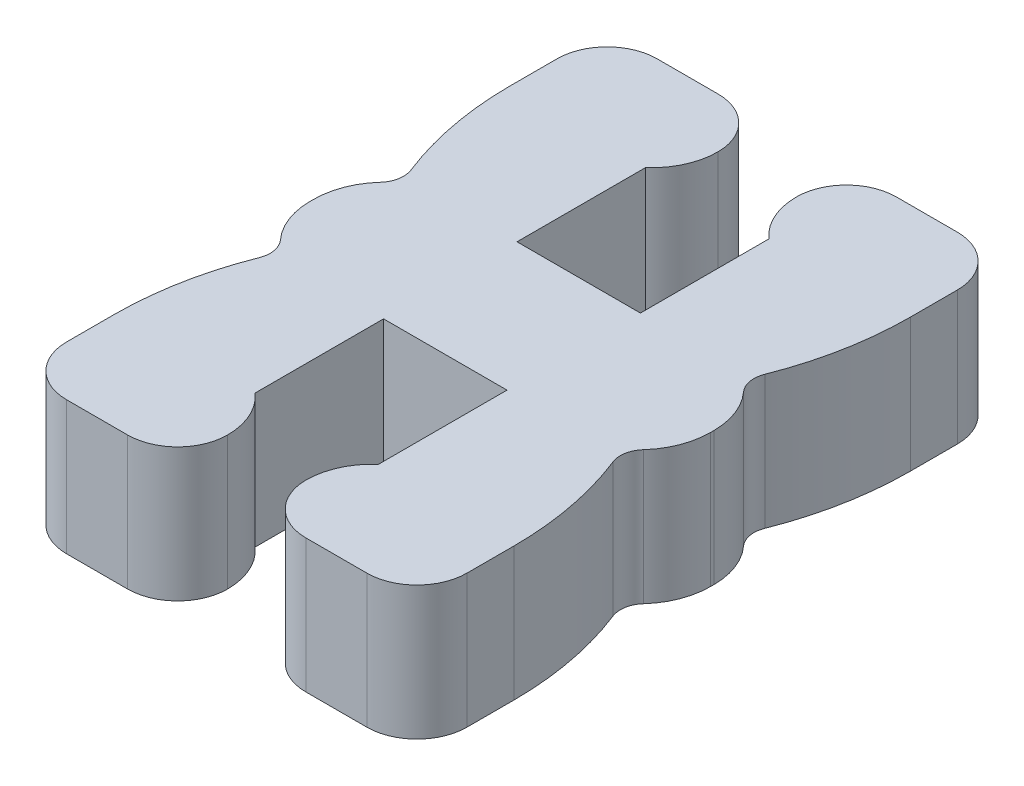
from build123d import *

# Parameters (mm, degrees)
BOSS_EXTRUDE2_DEPTH = 4
FILLET1_R           = 10
FILLET2_R           = 2.15
FILLET3_R           = 1.5


with BuildPart() as part:
    # Sketch1 → Boss-Extrude2 (new body)
    with BuildSketch(Plane(origin=(0, 0, 0), x_dir=(1, 0, 0), z_dir=(0, 1, 0))):
        with BuildLine():
            Line((6, -1.25), (6, 1.25))
            ThreePointArc((6, 1.25), (5.25, 2), (6, 2.75))
            Line((6, 2.75), (6, 8.85))
            Line((6, 8.85), (1.85, 8.85))
            ThreePointArc((1.85, 8.85), (1.172875656, 7.35), (1.85, 5.85))
            Line((1.85, 5.85), (1.85, 2))
            Line((1.85, 2), (-1.85, 2))
            Line((-1.85, 2), (-1.85, 5.85))
            ThreePointArc((-1.85, 5.85), (-1.172875656, 7.35), (-1.85, 8.85))
            Line((-1.85, 8.85), (-6, 8.85))
            Line((-6, 8.85), (-6, 2.75))
            ThreePointArc((-6, 2.75), (-5.25, 2), (-6, 1.25))
            Line((-6, 1.25), (-6, -1.25))
            ThreePointArc((-6, -1.25), (-5.25, -2), (-6, -2.75))
            Line((-6, -2.75), (-6, -8.85))
            Line((-6, -8.85), (-1.85, -8.85))
            ThreePointArc((-1.85, -8.85), (-1.172875656, -7.35), (-1.85, -5.85))
            Line((-1.85, -5.85), (-1.85, -2))
            Line((-1.85, -2), (1.85, -2))
            Line((1.85, -2), (1.85, -5.85))
            ThreePointArc((1.85, -5.85), (1.172875656, -7.35), (1.85, -8.85))
            Line((1.85, -8.85), (6, -8.85))
            Line((6, -8.85), (6, -2.75))
            ThreePointArc((6, -2.75), (5.25, -2), (6, -1.25))
        make_face()
    extrude(amount=BOSS_EXTRUDE2_DEPTH)

    # Fillet1
    fillet1_edges = [part.edges().sort_by_distance(p)[0] for p in [
        (-6, 2, 2.75),
        (-6, 2, -2.75),
        (6, 2, -2.75),
        (6, 2, 2.75),
    ]]
    fillet(fillet1_edges, radius=FILLET1_R)

    # Fillet2
    fillet2_edges = [part.edges().sort_by_distance(p)[0] for p in [
        (-6, 2, 1.25),
        (-6, 2, -1.25),
        (6, 2, -1.25),
        (6, 2, 1.25),
    ]]
    fillet(fillet2_edges, radius=FILLET2_R)

    # Fillet3
    fillet3_edges = [part.edges().sort_by_distance(p)[0] for p in [
        (-1.85, 2, 8.85),
        (-6, 2, 8.85),
        (-6, 2, -8.85),
        (-1.85, 2, -8.85),
        (1.85, 2, -8.85),
        (6, 2, -8.85),
        (6, 2, 8.85),
        (1.85, 2, 8.85),
    ]]
    fillet(fillet3_edges, radius=FILLET3_R)


solid = part.part
